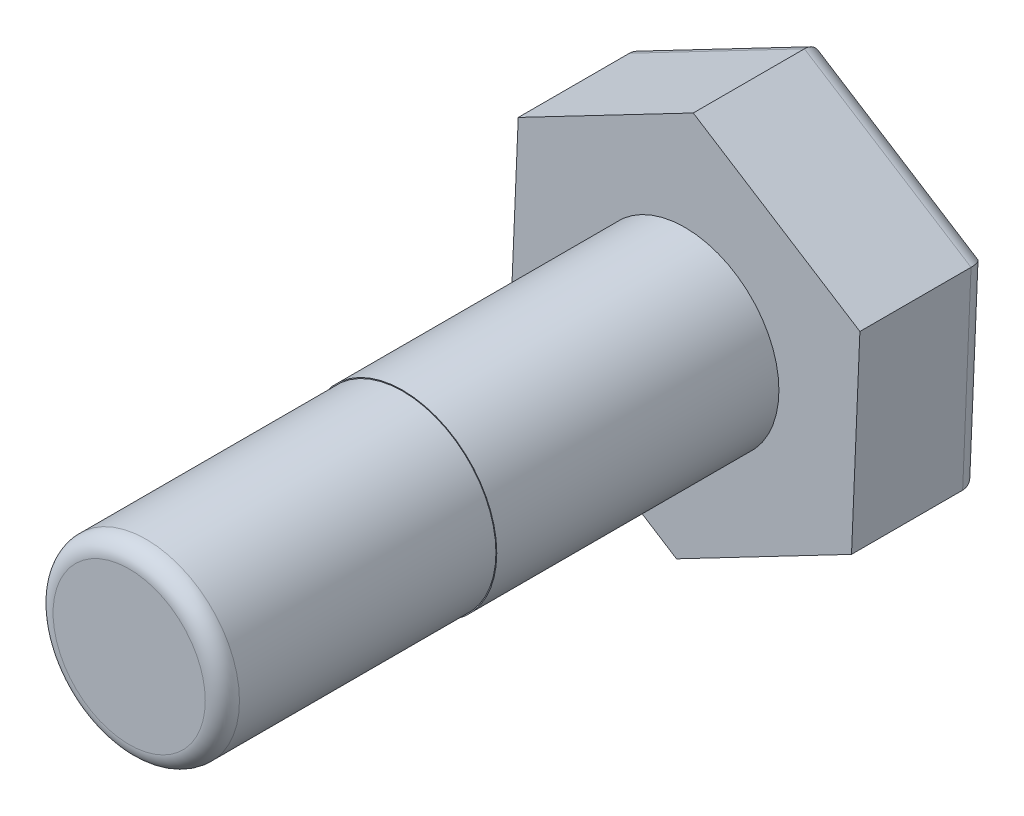
from build123d import *

# Parameters (mm, degrees)
EXTRUDE_462_DEPTH = 15
SKETCH_2_R        = 11
EXTRUDE_1_DEPTH   = 33
FILLET_3_R        = 2
SKETCH_3_R        = 10.9
EXTRUDE_1_2_DEPTH = 32
FILLET_4_R        = 2


with BuildPart() as part:
    # 草图1 → Extrude 462 (new body)
    with BuildSketch(Plane.XY):
        Polygon((20.472392036, 10.687118304), (0.980880074, 23.073170732), (-19.491511963, 12.386052428), (-20.472392036, -10.687118304), (-0.980880074, -23.073170732), (19.491511963, -12.386052428), align=None)
    extrude(amount=EXTRUDE_462_DEPTH)

    # 草图2 → Extrude 1 (add)
    with BuildSketch(Plane.XY.offset(15)):
        Circle(SKETCH_2_R)
    extrude(amount=EXTRUDE_1_DEPTH)

    # 圆角3
    fillet_3_edges = [part.edges().sort_by_distance(p)[0] for p in [
        (9.255315945, -17.72961158, 0),
        (-10.726636055, -16.880144518, 0),
        (-19.981952, 0.849467062, 0),
        (-9.255315945, 17.72961158, 0),
        (10.726636055, 16.880144518, 0),
        (19.981952, -0.849467062, 0),
    ]]
    fillet(fillet_3_edges, radius=FILLET_3_R)

    # 草图3 → Extrude 1 2 (add)
    with BuildSketch(Plane.XY.offset(48)):
        Circle(SKETCH_3_R)
    extrude(amount=EXTRUDE_1_2_DEPTH)

    # 圆角4
    fillet_4_edges = [part.edges().sort_by_distance(p)[0] for p in [
        (-10.9, 0, 80),
    ]]
    fillet(fillet_4_edges, radius=FILLET_4_R)


solid = part.part
